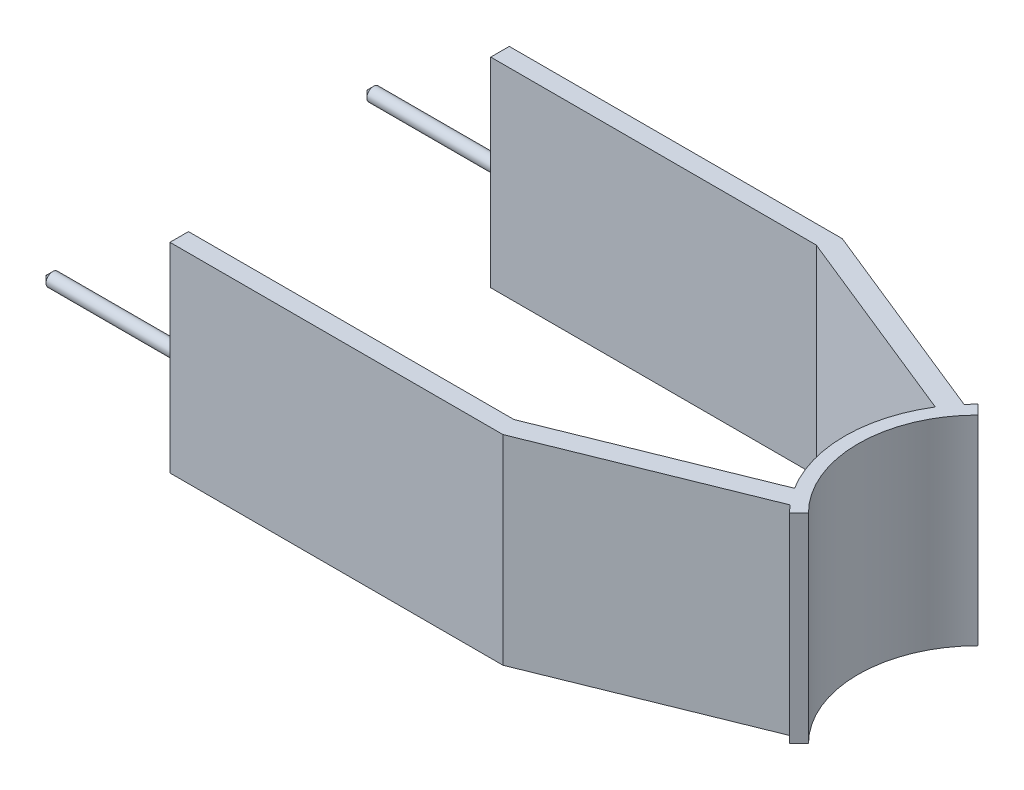
from build123d import *

# Parameters (mm, degrees)
BOSS_EXTRUDE2_DEPTH      = 30
BOSS_EXTRUDE3_START      = -30
BOSS_EXTRUDE3_DEPTH      = 30
BOSS_EXTRUDE4_DEPTH      = 30
SKETCH15_R               = 1
BOSS_EXTRUDE5_DEPTH      = 20
CHAMFER1_SIZE            = 1
CHAMFER1_OF_MIRROR2_SIZE = 1


with BuildPart() as part:
    # Sketch5 → Boss-Extrude2 (new body)
    with BuildSketch(Plane(origin=(0, 0, 0), x_dir=(1, 0, 0), z_dir=(0, 1, 0))):
        with BuildLine():
            Line((-12.727922061, 12.727922061), (-14.142135624, 14.142135624))
            ThreePointArc((-14.142135624, 14.142135624), (-20, 0), (-14.142135624, -14.142135624))
            Line((-14.142135624, -14.142135624), (-12.727922061, -12.727922061))
            ThreePointArc((-12.727922061, -12.727922061), (-18, 0), (-12.727922061, 12.727922061))
        make_face()
    extrude(amount=BOSS_EXTRUDE2_DEPTH)

    # Sketch12 → Boss-Extrude3 (add)
    with BuildSketch(Plane(origin=(0, 30, 0), x_dir=(1, 0, 0), z_dir=(0, 1, 0)).offset(BOSS_EXTRUDE3_START)):
        with BuildLine():
            Line((-16.979679072, 10.568372562), (-46.979679072, 22.693353002))
            Line((-46.979679072, 22.693353002), (-45.855525051, 25.474769501))
            Line((-45.855525051, 25.474769501), (-15.144925587, 13.062588907))
            ThreePointArc((-15.144925587, 13.062588907), (-14.653475488, 13.611600058), (-14.142135624, 14.142135624))
            Line((-14.142135624, 14.142135624), (-12.727922061, 12.727922061))
            ThreePointArc((-12.727922061, 12.727922061), (-18, 0), (-12.727922061, -12.727922061))
            Line((-12.727922061, -12.727922061), (-14.142135624, -14.142135624))
            ThreePointArc((-14.142135624, -14.142135624), (-19.869427299, -2.281635118), (-16.979679072, 10.568372562))
        make_face()
    boss_extrude3 = extrude(amount=BOSS_EXTRUDE3_DEPTH)

    # Sketch14 → Boss-Extrude4 (add)
    with BuildSketch(Plane(origin=(0, 30, 0), x_dir=(1, 0, 0), z_dir=(0, 1, 0))):
        Polygon((-45.855525051, 25.474769501), (-95.855525051, 25.474769501), (-95.855525051, 22.693353002), (-46.979679072, 22.693353002), align=None)
    boss_extrude4 = extrude(amount=-BOSS_EXTRUDE4_DEPTH)

    # Mirror1: Boss-Extrude3, Boss-Extrude4 across plane
    add(boss_extrude3.mirror(Plane(origin=(0, 0, 0), x_dir=(1, 0, 0), z_dir=(0, 0, -1))))
    add(boss_extrude4.mirror(Plane(origin=(0, 0, 0), x_dir=(1, 0, 0), z_dir=(0, 0, -1))))

    # Sketch15 → Boss-Extrude5 (add)
    with BuildSketch(Plane.ZY.offset(95.855525051)):
        with Locations(Location((24.084061252, 15, 0), (0, 0, 180))):
            Circle(SKETCH15_R)
    boss_extrude5 = extrude(amount=BOSS_EXTRUDE5_DEPTH)

    # Chamfer1
    chamfer1_edges = [part.edges().sort_by_distance(p)[0] for p in [
        (-115.855525051, 15, 25.084061252),
    ]]
    chamfer(chamfer1_edges, length=CHAMFER1_SIZE)

    # Mirror2: Boss-Extrude5 across plane
    add(boss_extrude5.mirror(Plane(origin=(0, 0, 0), x_dir=(1, 0, 0), z_dir=(0, 0, -1))))

    # Chamfer1 of Mirror2
    chamfer1_of_mirror2_edges = [part.edges().sort_by_distance(p)[0] for p in [
        (-115.855525051, 15, -25.084061252),
    ]]
    chamfer(chamfer1_of_mirror2_edges, length=CHAMFER1_OF_MIRROR2_SIZE)


solid = part.part
